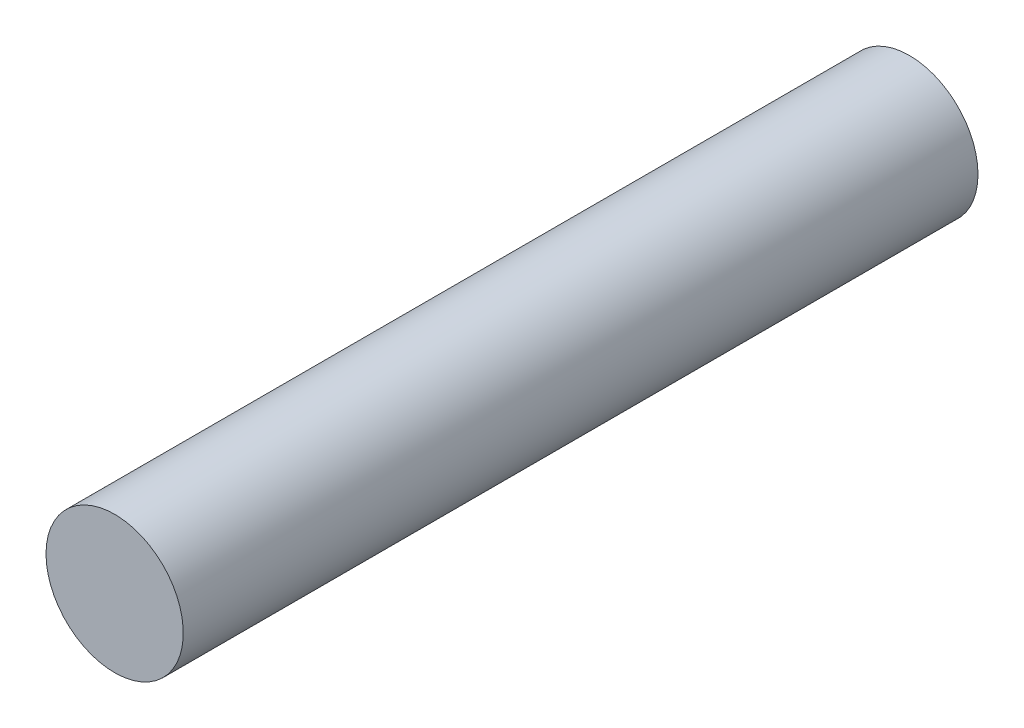
from build123d import *

# Parameters (mm, degrees)
SKETCH1_R               = 2.413
BOSS_EXTRUDE1_DEPTH     = 66.5
SKETCH2_W               = 4.826
SKETCH2_H               = 0.508
CUT_EXTRUDE1_DEPTH      = 6
CUT_EXTRUDE2_DEPTH      = 67.587499863
CUT_EXTRUDE2_DEPTH_BACK = 67.587499863
SKETCH3_W               = 4.826
SKETCH3_H               = 105.06


with BuildPart() as part:
    # Sketch1 → Boss-Extrude1 (new, symmetric)
    with BuildSketch(Plane.XY):
        Circle(SKETCH1_R)
    extrude(amount=BOSS_EXTRUDE1_DEPTH, both=True)

    # Sketch2 → Cut-Extrude1 (cut)
    with BuildSketch(Plane.XY.offset(66.5)):
        with Locations((0, 2.159)):
            Rectangle(SKETCH2_W, SKETCH2_H)
    extrude(amount=-CUT_EXTRUDE1_DEPTH, mode=Mode.SUBTRACT)

    # Sketch3 → Cut-Extrude2 (cut, two sides: drawn at the far end of the back side and taken through both)
    with BuildSketch(Plane(origin=(0, 0, 0), x_dir=(1, 0, 0), z_dir=(0, 1, 0)).offset(-CUT_EXTRUDE2_DEPTH_BACK)):
        with Locations((0, -13.97)):
            Rectangle(SKETCH3_W, SKETCH3_H)
    extrude(amount=CUT_EXTRUDE2_DEPTH + CUT_EXTRUDE2_DEPTH_BACK, mode=Mode.SUBTRACT)


solid = part.part
